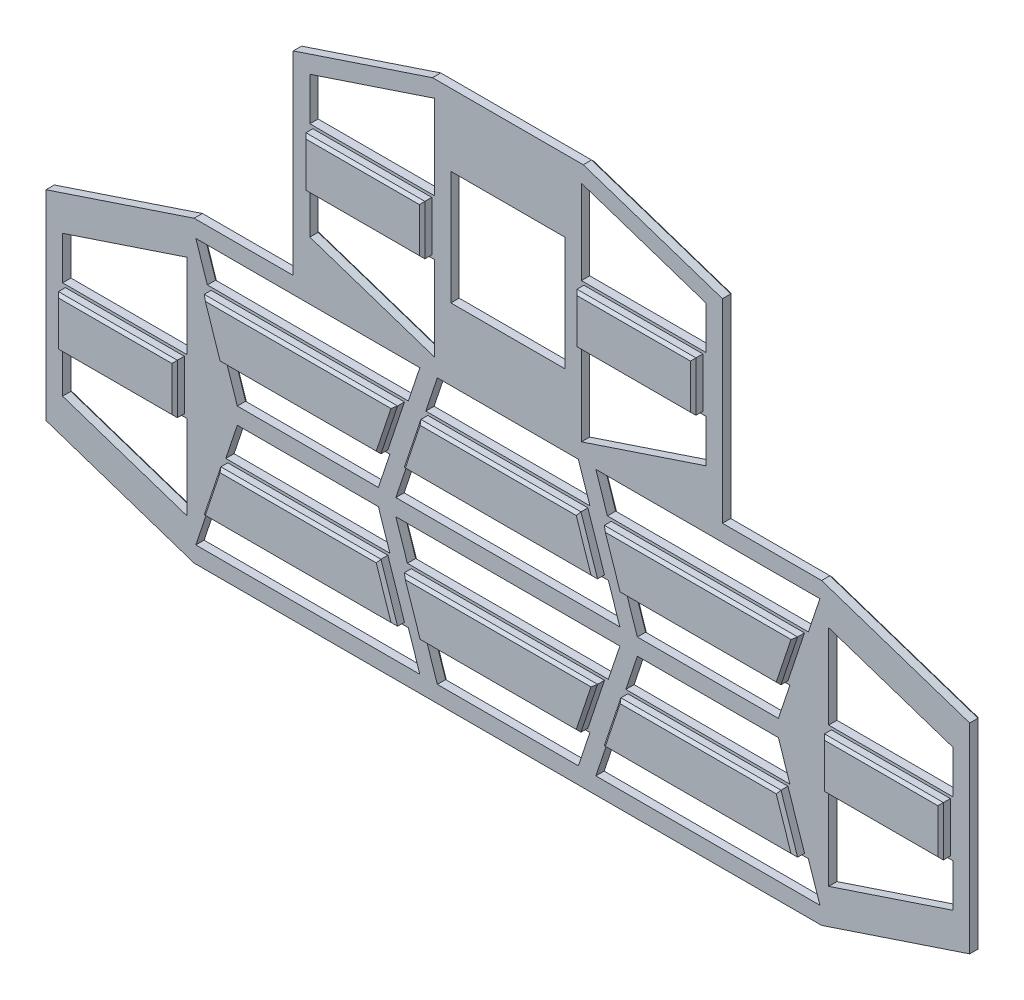
from build123d import *

# Parameters (mm, degrees)
SKETCH1_W           = 20.6
SKETCH1_H           = 20.6
BOSS_EXTRUDE1_DEPTH = 2
SKETCH2_W           = 22.5
SKETCH2_H           = 10
BOSS_EXTRUDE2_DEPTH = 2
SKETCH3_W           = 21.5
SKETCH3_H           = 9
BOSS_EXTRUDE3_DEPTH = 1.75
CHAMFER1_SIZE       = 0.5


with BuildPart() as part:
    # Sketch1 → Boss-Extrude1 (new body)
    with BuildSketch(Plane.XY):
        Polygon((-13.636832981, 23.3), (13.636832981, 23.3), (38.8, 14.91227766), (38.8, -20.25), (56.723665961, -20.25), (83.5, -29.17544468), (83.5, -65.32455532), (56.723665961, -74.25), (-56.723665961, -74.25), (-83.5, -65.32455532), (-83.5, -29.17544468), (-56.723665961, -20.25), (-38.8, -20.25), (-38.8, 14.91227766), align=None)
        Polygon((-13.3, 20.25), (-13.3, -20.25), (-35.8, -12.75), (-35.8, 12.75), align=None, mode=Mode.SUBTRACT)
        Rectangle(SKETCH1_W, SKETCH1_H, mode=Mode.SUBTRACT)
        Polygon((13.3, -20.25), (35.8, -12.75), (35.8, 12.75), (13.3, 20.25), align=None, mode=Mode.SUBTRACT)
        Polygon((48.91227766, -48.75), (56.41227766, -71.25), (15.91227766, -71.25), (23.41227766, -48.75), align=None, mode=Mode.SUBTRACT)
        Polygon((-12.75, -23.25), (12.75, -23.25), (20.25, -45.75), (-20.25, -45.75), align=None, mode=Mode.SUBTRACT)
        Polygon((15.91227766, -23.25), (23.41227766, -45.75), (48.91227766, -45.75), (56.41227766, -23.25), align=None, mode=Mode.SUBTRACT)
        Polygon((-48.91227766, -45.75), (-56.41227766, -23.25), (-15.91227766, -23.25), (-23.41227766, -45.75), align=None, mode=Mode.SUBTRACT)
        Polygon((-23.41227766, -48.75), (-48.91227766, -48.75), (-56.41227766, -71.25), (-15.91227766, -71.25), align=None, mode=Mode.SUBTRACT)
        Polygon((20.25, -48.75), (-20.25, -48.75), (-12.75, -71.25), (12.75, -71.25), align=None, mode=Mode.SUBTRACT)
        Polygon((58, -67.5), (58, -27), (80.5, -34.5), (80.5, -60), align=None, mode=Mode.SUBTRACT)
        Polygon((-58, -27), (-80.5, -34.5), (-80.5, -60), (-58, -67.5), align=None, mode=Mode.SUBTRACT)
    extrude(amount=BOSS_EXTRUDE1_DEPTH)

    # Sketch2 → Boss-Extrude2 (add)
    with BuildSketch(Plane.XY):
        with Locations((-69.25, -47.25)):
            Rectangle(SKETCH2_W, SKETCH2_H)
        with Locations((69.25, -47.25)):
            Rectangle(SKETCH2_W, SKETCH2_H)
        Polygon((17.995610994, -29.5), (21.328944327, -39.5), (50.995610994, -39.5), (54.328944327, -29.5), align=None)
        Polygon((54.328944327, -65), (50.995610994, -55), (21.328944327, -55), (17.995610994, -65), align=None)
        Polygon((14.833333333, -65), (18.166666667, -55), (-18.166666667, -55), (-14.833333333, -65), align=None)
        Polygon((18.166666667, -39.5), (14.833333333, -29.5), (-14.833333333, -29.5), (-18.166666667, -39.5), align=None)
        Polygon((-17.995610994, -65), (-21.328944327, -55), (-50.995610994, -55), (-54.328944327, -65), align=None)
        Polygon((-21.328944327, -39.5), (-17.995610994, -29.5), (-54.328944327, -29.5), (-50.995610994, -39.5), align=None)
        with Locations((24.55, 0)):
            Rectangle(SKETCH2_W, SKETCH2_H)
        with Locations((-24.55, 0)):
            Rectangle(SKETCH2_W, SKETCH2_H)
    extrude(amount=BOSS_EXTRUDE2_DEPTH)

    # Sketch3 → Boss-Extrude3 (add)
    with BuildSketch(Plane.XY.offset(2)):
        with Locations((-24.5, 0)):
            Rectangle(SKETCH3_W, SKETCH3_H)
        with Locations((24.5, 0)):
            Rectangle(SKETCH3_W, SKETCH3_H)
        Polygon((-17.472953723, -39), (17.472953723, -39), (14.472953723, -30), (-14.472953723, -30), align=None)
        Polygon((21.689323937, -39), (50.635231383, -39), (53.635231383, -30), (18.689323937, -30), align=None)
        Polygon((-53.635231383, -30), (-18.689323937, -30), (-21.689323937, -39), (-50.635231383, -39), align=None)
        Polygon((18.689323937, -64.5), (21.689323937, -55.5), (50.635231383, -55.5), (53.635231383, -64.5), align=None)
        Polygon((-14.472953723, -64.5), (-17.472953723, -55.5), (17.472953723, -55.5), (14.472953723, -64.5), align=None)
        Polygon((-50.635231383, -55.5), (-53.635231383, -64.5), (-18.689323937, -64.5), (-21.689323937, -55.5), align=None)
        with Locations((-69.25, -47.25)):
            Rectangle(SKETCH3_W, SKETCH3_H)
        with Locations((69.25, -47.25)):
            Rectangle(SKETCH3_W, SKETCH3_H)
    extrude(amount=BOSS_EXTRUDE3_DEPTH)

    # Chamfer1
    chamfer1_edges = [part.edges().sort_by_distance(p)[0] for p in [
        (-36.16227766, -45.75, 0),
        (-22.370610994, -42.625, 0),
        (-36.16227766, -23.25, 0),
        (-55.370610994, -26.375, 0),
        (36.16227766, -48.75, 0),
        (22.370610994, -51.875, 0),
        (36.16227766, -71.25, 0),
        (55.370610994, -68.125, 0),
        (-16.953944327, -68.125, 0),
        (-36.16227766, -48.75, 0),
        (-49.953944327, -51.875, 0),
        (-36.16227766, -71.25, 0),
        (0, 23.3, 0),
        (13.791666667, -68.125, 0),
        (0, -48.75, 0),
        (-19.208333333, -51.875, 0),
        (0, -71.25, 0),
        (26.21841649, 19.10613883, 0),
        (38.8, -2.66886117, 0),
        (47.761832981, -20.25, 0),
        (-58, -59.875, 0),
        (-69.25, -30.75, 0),
        (70.111832981, -24.71272234, 0),
        (-80.5, -38.375, 0),
        (-69.25, -63.75, 0),
        (83.5, -47.25, 0),
        (70.111832981, -69.78727766, 0),
        (0, -74.25, 0),
        (69.25, -30.75, 0),
        (58, -34.625, 0),
        (69.25, -63.75, 0),
        (80.5, -56.125, 0),
        (-70.111832981, -69.78727766, 0),
        (-83.5, -47.25, 0),
        (-70.111832981, -24.71272234, 0),
        (-47.761832981, -20.25, 0),
        (-38.8, -2.66886117, 0),
        (-26.21841649, 19.10613883, 0),
        (-13.3, 12.625, 0),
        (-35.8, -8.875, 0),
        (-24.55, 5, 0),
        (-24.55, -5, 0),
        (-49.953944327, -42.625, 0),
        (-16.953944327, -26.375, 0),
        (-36.16227766, -29.5, 0),
        (-36.16227766, -39.5, 0),
        (13.791666667, -26.375, 0),
        (-19.208333333, -42.625, 0),
        (0, -29.5, 0),
        (0, -39.5, 0),
        (55.370610994, -26.375, 0),
        (22.370610994, -42.625, 0),
        (36.16227766, -29.5, 0),
        (36.16227766, -39.5, 0),
        (49.953944327, -51.875, 0),
        (16.953944327, -68.125, 0),
        (36.16227766, -55, 0),
        (36.16227766, -65, 0),
        (-13.791666667, -68.125, 0),
        (19.208333333, -51.875, 0),
        (0, -65, 0),
        (0, -55, 0),
        (-55.370610994, -68.125, 0),
        (-22.370610994, -51.875, 0),
        (-36.16227766, -55, 0),
        (-36.16227766, -65, 0),
        (35.8, 8.875, 0),
        (13.3, -12.625, 0),
        (24.55, -5, 0),
        (24.55, 5, 0),
        (-80.5, -56.125, 0),
        (-58, -34.625, 0),
        (-69.25, -52.25, 0),
        (-69.25, -42.25, 0),
        (80.5, -38.375, 0),
        (58, -59.875, 0),
        (69.25, -42.25, 0),
        (69.25, -52.25, 0),
        (24.5, 4.5, 3.75),
        (13.75, 0, 3.75),
        (24.5, -4.5, 3.75),
        (35.25, 0, 3.75),
        (-13.75, 0, 3.75),
        (-24.5, 4.5, 3.75),
        (-35.25, 0, 3.75),
        (-24.5, -4.5, 3.75),
        (36.16227766, -64.5, 3.75),
        (52.135231383, -60, 3.75),
        (36.16227766, -55.5, 3.75),
        (20.189323937, -60, 3.75),
        (10.3, 0, 0),
        (0, -64.5, 3.75),
        (15.972953723, -60, 3.75),
        (0, -55.5, 3.75),
        (-15.972953723, -60, 3.75),
        (0, 10.3, 0),
        (-10.3, 0, 0),
        (0, -10.3, 0),
        (-36.16227766, -55.5, 3.75),
        (-52.135231383, -60, 3.75),
        (-36.16227766, -64.5, 3.75),
        (-20.189323937, -60, 3.75),
        (-52.135231383, -34.5, 3.75),
        (-36.16227766, -39, 3.75),
        (-20.189323937, -34.5, 3.75),
        (-36.16227766, -30, 3.75),
        (-15.972953723, -34.5, 3.75),
        (0, -39, 3.75),
        (15.972953723, -34.5, 3.75),
        (0, -30, 3.75),
        (20.189323937, -34.5, 3.75),
        (36.16227766, -39, 3.75),
        (52.135231383, -34.5, 3.75),
        (36.16227766, -30, 3.75),
        (69.25, -42.75, 3.75),
        (58.5, -47.25, 3.75),
        (69.25, -51.75, 3.75),
        (80, -47.25, 3.75),
        (-58.5, -47.25, 3.75),
        (-69.25, -42.75, 3.75),
        (-80, -47.25, 3.75),
        (-69.25, -51.75, 3.75),
        (-24.55, 16.5, 0),
        (-35.8, 8.875, 0),
        (-24.55, -16.5, 0),
        (-13.3, -12.625, 0),
        (13.3, 12.625, 0),
        (24.55, -16.5, 0),
        (35.8, -8.875, 0),
        (24.55, 16.5, 0),
        (-13.791666667, -26.375, 0),
        (0, -45.75, 0),
        (19.208333333, -42.625, 0),
        (0, -23.25, 0),
        (36.16227766, -23.25, 0),
        (16.953944327, -26.375, 0),
        (36.16227766, -45.75, 0),
        (49.953944327, -42.625, 0),
    ]]
    chamfer(chamfer1_edges, length=CHAMFER1_SIZE)


solid = part.part
